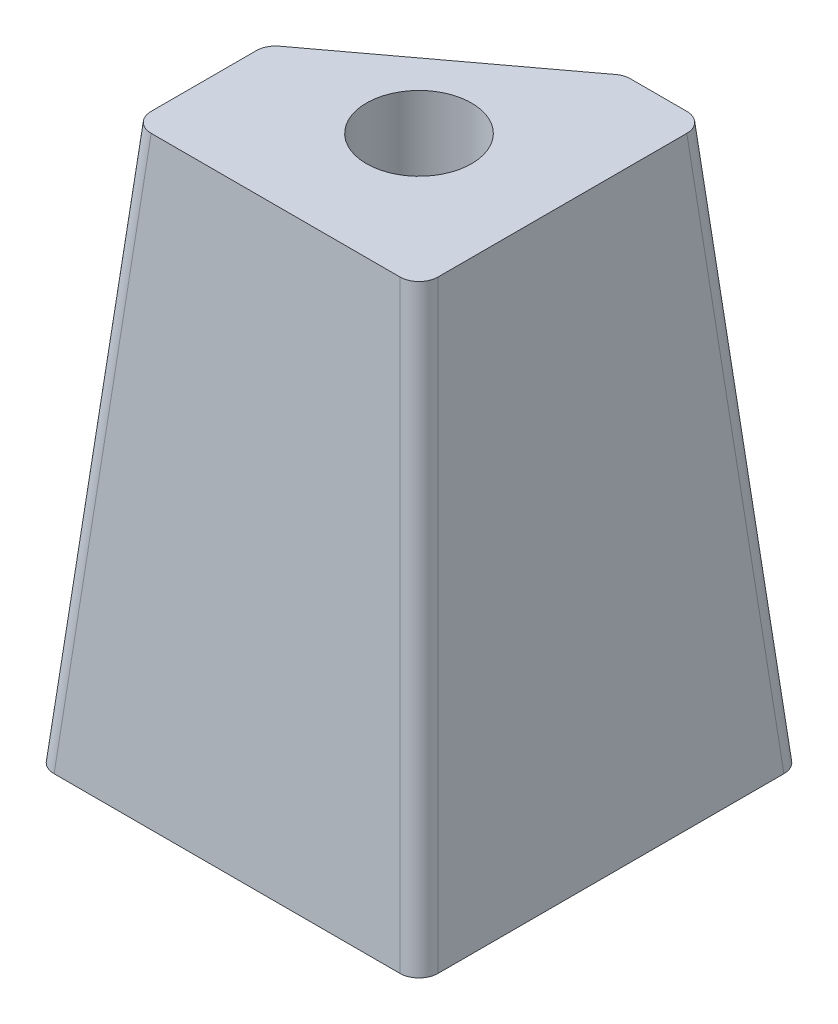
from build123d import *

# Parameters (mm, degrees)
BOSS_EXTRUDE1_DEPTH = 29
SKETCH2_R           = 1.5
SKETCH2_R_2         = 2
CUT_EXTRUDE1_DEPTH  = 10
SKETCH3_R           = 2.75
CUT_EXTRUDE2_DEPTH  = 6
DRAFT1_ANGLE        = 5
FILLET1_R           = 1


with BuildPart() as part:
    # Sketch1 → Boss-Extrude1 (new body)
    with BuildSketch(Plane(origin=(0, 0, 0), x_dir=(1, 0, 0), z_dir=(0, 1, 0))):
        Polygon((-4.579646018, -0.201327434), (6.153177369, 7.798672566), (10.420353982, 7.798672566), (10.420353982, -7.201327434), (-4.579646018, -7.201327434), align=None)
    extrude(amount=BOSS_EXTRUDE1_DEPTH)

    # Sketch2 → Cut-Extrude1 (cut)
    with BuildSketch(Plane.XZ):
        with Locations(Location((-0.579646018, 2.201327434, 0), (0, 0, 270))):
            Circle(SKETCH2_R)
        with Locations(Location((7.420353982, 2.201327434, 0), (0, 0, 270))):
            Circle(SKETCH2_R_2)
    extrude(amount=-CUT_EXTRUDE1_DEPTH, mode=Mode.SUBTRACT)

    # Sketch3 → Cut-Extrude2 (cut)
    with BuildSketch(Plane(origin=(0, 29, 0), x_dir=(1, 0, 0), z_dir=(0, 1, 0))):
        with Locations(Location((3.420353982, -0.201327434, 0), (0, 0, 270))):
            Circle(SKETCH3_R)
    extrude(amount=-CUT_EXTRUDE2_DEPTH, mode=Mode.SUBTRACT)

    # Draft1
    draft1_faces = [part.faces().sort_by_distance(p)[0] for p in [
        (8.286765676, 14.5, -7.798672566),
        (10.420353982, 14.5, -0.298672566),
        (2.920353982, 14.5, 7.201327434),
        (-4.579646018, 14.5, 3.701327434),
        (0.786765676, 14.5, -3.798672566),
    ]]
    draft(draft1_faces, Plane.ZX.offset(29), DRAFT1_ANGLE)

    # Fillet1
    fillet1_edges = [part.edges().sort_by_distance(p)[0] for p in [
        (-5.848231639, 14.5, -0.435318187),
        (5.7324043, 14.5, -9.067258187),
        (11.688939603, 14.5, -9.067258187),
        (11.688939603, 14.5, 8.469913055),
        (-5.848231639, 14.5, 8.469913055),
    ]]
    fillet(fillet1_edges, radius=FILLET1_R)


solid = part.part
